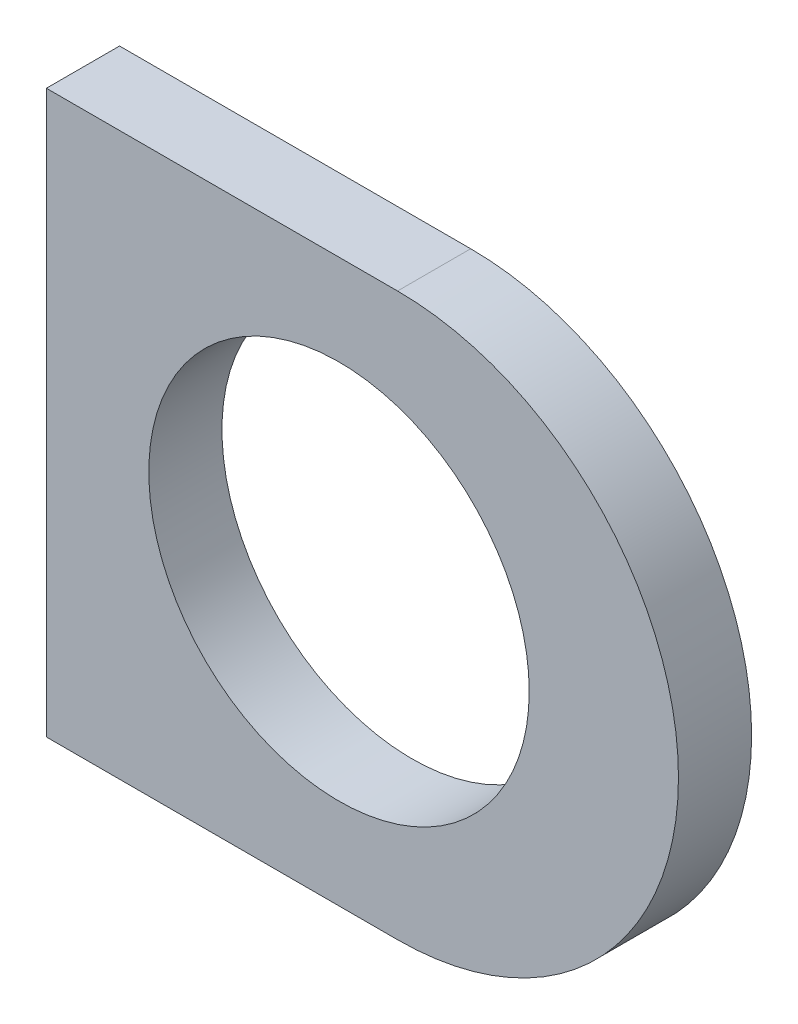
from build123d import *

# Parameters (mm, degrees)
BOSS_EXTRUDE1_DEPTH     = 12.5
CUT_EXTRUDE1_DEPTH      = 78.847607542
CUT_EXTRUDE1_DEPTH_BACK = 78.847607542
SKETCH2_R               = 32.5


with BuildPart() as part:
    # Sketch1 → Boss-Extrude1 (new body)
    with BuildSketch(Plane.XY):
        with BuildLine():
            Line((-60, 48), (-60, -48))
            Line((-60, -48), (0, -48))
            ThreePointArc((0, -48), (48, 0), (0, 48))
            Line((0, 48), (-60, 48))
        make_face()
    extrude(amount=BOSS_EXTRUDE1_DEPTH)

    # Sketch2 → Cut-Extrude1 (cut, two sides: drawn at the far end of the back side and taken through both)
    with BuildSketch(Plane.XY.offset(-CUT_EXTRUDE1_DEPTH_BACK)):
        with Locations((-10, 0)):
            Circle(SKETCH2_R)
    extrude(amount=CUT_EXTRUDE1_DEPTH + CUT_EXTRUDE1_DEPTH_BACK, mode=Mode.SUBTRACT)


solid = part.part
